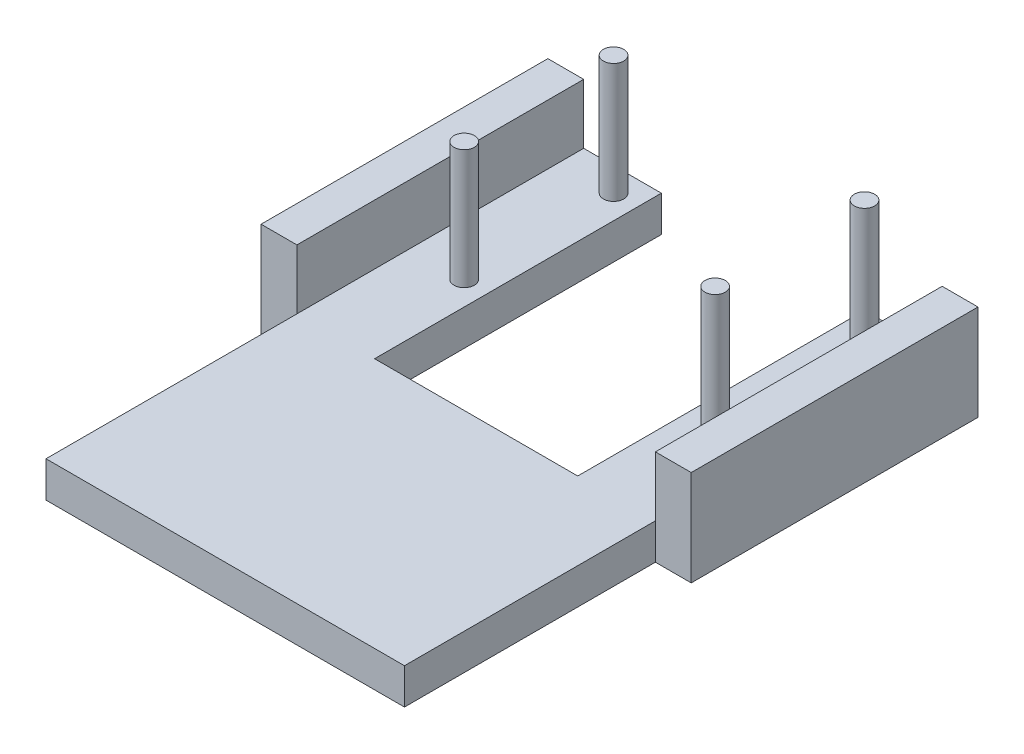
from build123d import *

# Parameters (mm, degrees)
BOSS_EXTRUDE1_DEPTH = 3
SKETCH2_R           = 0.85
SKETCH2_W           = 3
SKETCH2_H           = 24
BOSS_EXTRUDE2_DEPTH = 5
SKETCH3_R           = 0.85
BOSS_EXTRUDE3_DEPTH = 5


with BuildPart() as part:
    # Sketch1 → Boss-Extrude1 (new body)
    with BuildSketch(Plane(origin=(0, 0, 0), x_dir=(1, 0, 0), z_dir=(0, 1, 0))):
        Polygon((30, 0), (0, 0), (0, 21), (-3, 21), (-3, 45), (6.5, 45), (6.5, 21), (23.5, 21), (23.5, 45), (33, 45), (33, 21), (30, 21), align=None)
    extrude(amount=BOSS_EXTRUDE1_DEPTH)

    # Sketch2 → Boss-Extrude2 (add)
    with BuildSketch(Plane(origin=(0, 3, 0), x_dir=(1, 0, 0), z_dir=(0, 1, 0))):
        with Locations(Location((4.5, 43, 0), (0, 0, 90))):
            Circle(SKETCH2_R)
        with Locations(Location((25.5, 43, 0), (0, 0, 90))):
            Circle(SKETCH2_R)
        with Locations(Location((25.5, 30.5, 0), (0, 0, 90))):
            Circle(SKETCH2_R)
        with Locations(Location((4.5, 30.5, 0), (0, 0, 90))):
            Circle(SKETCH2_R)
        with Locations((-1.5, 33)):
            Rectangle(SKETCH2_W, SKETCH2_H)
        with Locations((31.5, 33)):
            Rectangle(SKETCH2_W, SKETCH2_H)
    extrude(amount=BOSS_EXTRUDE2_DEPTH)

    # Sketch3 → Boss-Extrude3 (add)
    with BuildSketch(Plane(origin=(0, 8, 0), x_dir=(1, 0, 0), z_dir=(0, 1, 0))):
        with Locations(Location((4.5, 43, 0), (0, 0, 90))):
            Circle(SKETCH3_R)
        with Locations(Location((25.5, 43, 0), (0, 0, 90))):
            Circle(SKETCH3_R)
        with Locations(Location((25.5, 30.5, 0), (0, 0, 90))):
            Circle(SKETCH3_R)
        with Locations(Location((4.5, 30.5, 0), (0, 0, 90))):
            Circle(SKETCH3_R)
    extrude(amount=BOSS_EXTRUDE3_DEPTH)


solid = part.part
